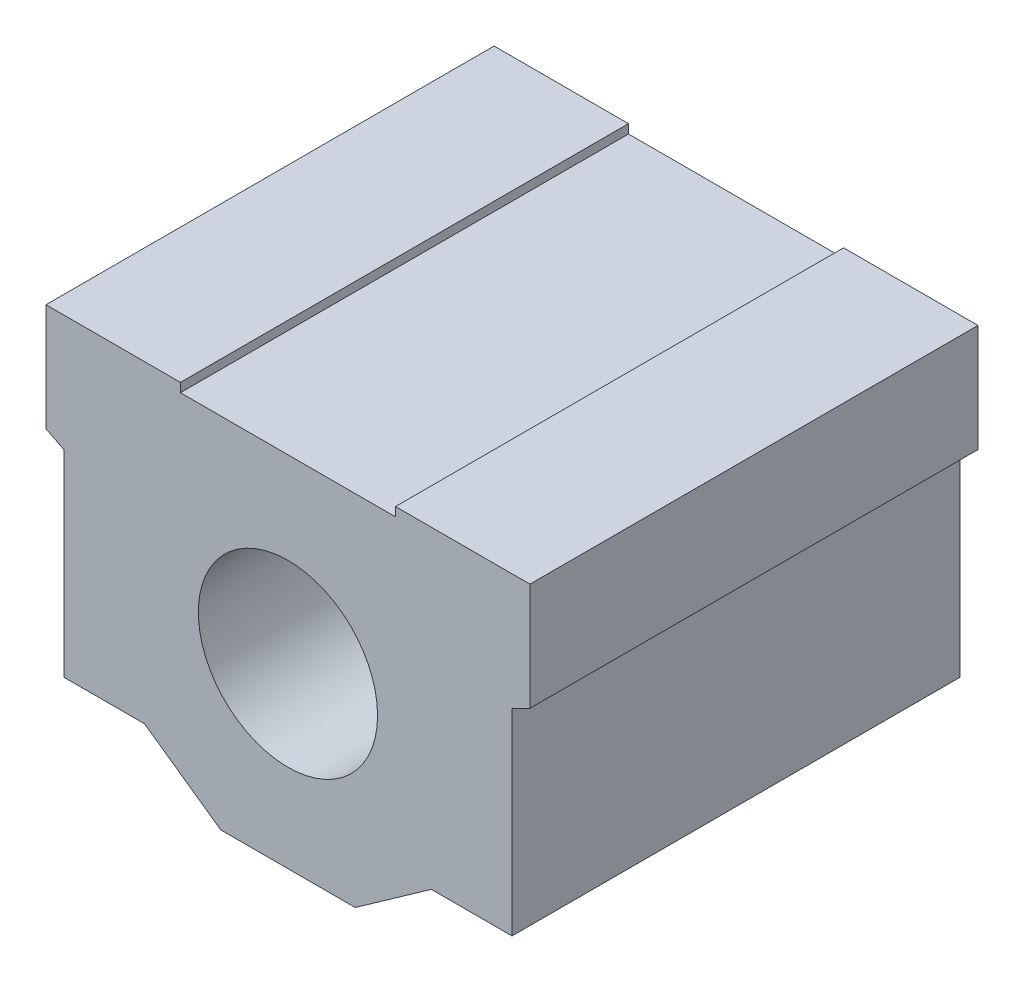
from build123d import *

# Parameters (mm, degrees)
SKETCH_1_R      = 10
EXTRUDE_1_DEPTH = 50


with BuildPart() as part:
    # 草图1 → 凸台-拉伸1 (new body)
    with BuildSketch(Plane.XY):
        Polygon((7.5, 0), (-7.5, 0), (-16, 6), (-25, 6), (-25, 28), (-27, 29), (-27, 41), (-12, 41), (-12, 40), (12, 40), (12, 41), (27, 41), (27, 29), (25, 28), (25, 6), (16, 6), align=None)
        with Locations((0, 19.8)):
            Circle(SKETCH_1_R, mode=Mode.SUBTRACT)
    extrude(amount=EXTRUDE_1_DEPTH)


solid = part.part
